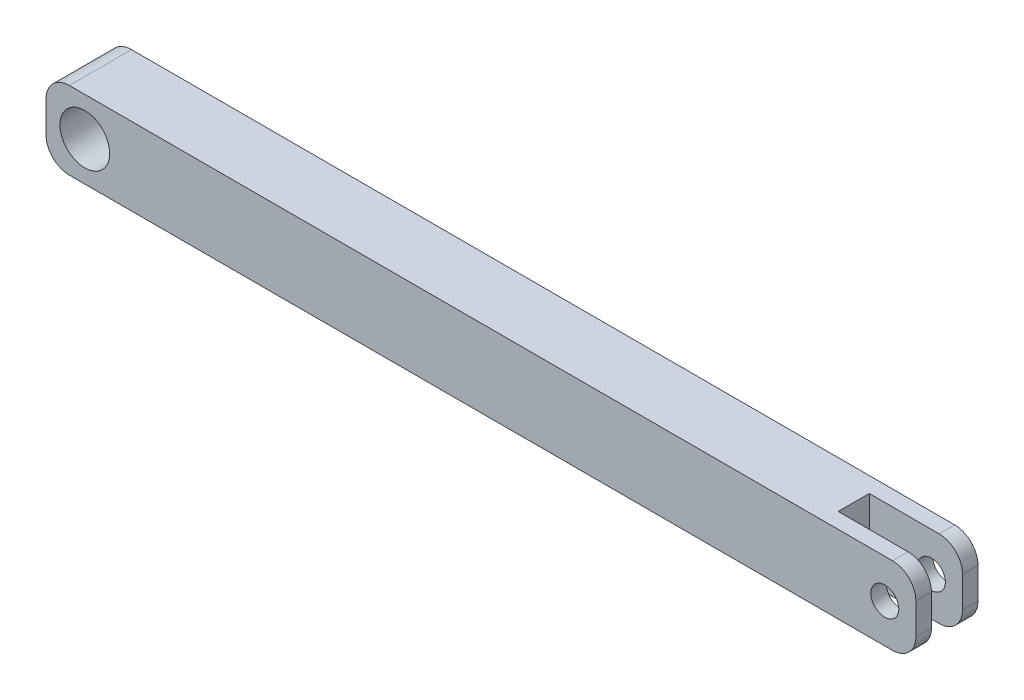
from build123d import *

# Parameters (mm, degrees)
SKETCH_5_W          = 56
SKETCH_5_H          = 3
EXTRUDE_1_DEPTH     = 5
CUT_EXTRUDE_1_REACH = 58.303
SKETCH_6_R          = 1.6
CUT_EXTRUDE_2_REACH = 58.303
SKETCH_7_R          = 0.9
FILLET_1_R          = 1.5
SKETCH_8_W          = 6
SKETCH_8_H          = 1.6
CUT_EXTRUDE_3_DEPTH = 10
SKETCH_10_R         = 1.6
SKETCH_10_R_2       = 0.9
EXTRUDE_2_DEPTH     = 0.5
EXTRUDE_START       = 0.5
SKETCH_11_R         = 0.9
SKETCH_11_R_2       = 1.6
EXTRUDE_3_DEPTH     = 0.5
SKETCH_12_W         = 6.20639004
SKETCH_12_H         = 2
CUT_EXTRUDE_4_DEPTH = 10


with BuildPart() as part:
    # 草图5 → 凸台-拉伸1 (new body)
    with BuildSketch(Plane(origin=(0, 0, 0), x_dir=(1, 0, 0), z_dir=(0, 1, 0))):
        with Locations((28, -1.5)):
            Rectangle(SKETCH_5_W, SKETCH_5_H)
    extrude(amount=EXTRUDE_1_DEPTH)

    # 草图6 → 切除-拉伸1 (cut, up to next)
    with BuildSketch(Plane.XY.offset(3), mode=Mode.PRIVATE) as cut_extrude_1_sk1:
        with Locations((2.5, 2.5)):
            Circle(SKETCH_6_R)
    cut_extrude_1_tool1 = extrude(cut_extrude_1_sk1.sketch, amount=-CUT_EXTRUDE_1_REACH, mode=Mode.PRIVATE) & part.part
    add(cut_extrude_1_tool1.solids().sort_by_distance((2.5, 2.5, 3))[0], mode=Mode.SUBTRACT)

    # 草图7 → 切除-拉伸2 (cut, up to next)
    with BuildSketch(Plane.XY, mode=Mode.PRIVATE) as cut_extrude_2_sk1:
        with Locations(Location((54, 2.5, 0), (0, 0, 180))):
            Circle(SKETCH_7_R)
    cut_extrude_2_tool1 = extrude(cut_extrude_2_sk1.sketch, amount=CUT_EXTRUDE_2_REACH, mode=Mode.PRIVATE) & part.part
    add(cut_extrude_2_tool1.solids().sort_by_distance((54, 2.5, 0))[0], mode=Mode.SUBTRACT)

    # 圆角1
    fillet_1_edges = [part.edges().sort_by_distance(p)[0] for p in [
        (56, 5, 1.5),
        (56, 0, 1.5),
        (0, 0, 1.5),
        (0, 5, 1.5),
    ]]
    fillet(fillet_1_edges, radius=FILLET_1_R)

    # 草图8 → 切除-拉伸3 (cut)
    with BuildSketch(Plane(origin=(0, 5, 0), x_dir=(1, 0, 0), z_dir=(0, 1, 0))):
        with Locations((53, -1.5)):
            Rectangle(SKETCH_8_W, SKETCH_8_H)
    extrude(amount=-CUT_EXTRUDE_3_DEPTH, mode=Mode.SUBTRACT)

    # 草图10 → 凸台-拉伸2 (add)
    with BuildSketch(Plane.XY.offset(3)):
        with BuildLine():
            Line((56, 1.5), (56, 3.5))
            ThreePointArc((56, 3.5), (55.560660172, 4.560660172), (54.5, 5))
            Line((54.5, 5), (1.5, 5))
            ThreePointArc((1.5, 5), (0.439339828, 4.560660172), (0, 3.5))
            Line((0, 3.5), (0, 1.5))
            ThreePointArc((0, 1.5), (0.439339828, 0.439339828), (1.5, 0))
            Line((1.5, 0), (54.5, 0))
            ThreePointArc((54.5, 0), (55.560660172, 0.439339828), (56, 1.5))
        make_face()
        with Locations((2.5, 2.5)):
            Circle(SKETCH_10_R, mode=Mode.SUBTRACT)
        with Locations(Location((54, 2.5, 0), (0, 0, 180))):
            Circle(SKETCH_10_R_2, mode=Mode.SUBTRACT)
    extrude(amount=EXTRUDE_2_DEPTH)

    # 草图11 → 凸台-拉伸3 (add)
    with BuildSketch(Plane(origin=(0, 0, 0), x_dir=(-1, 0, 0), z_dir=(0, 0, -1)).offset(EXTRUDE_START)):
        with BuildLine():
            Line((-1.5, 5), (-54.5, 5))
            ThreePointArc((-54.5, 5), (-55.560660172, 4.560660172), (-56, 3.5))
            Line((-56, 3.5), (-56, 1.5))
            ThreePointArc((-56, 1.5), (-55.560660172, 0.439339828), (-54.5, 0))
            Line((-54.5, 0), (-1.5, 0))
            ThreePointArc((-1.5, 0), (-0.439339828, 0.439339828), (0, 1.5))
            Line((0, 1.5), (0, 3.5))
            ThreePointArc((0, 3.5), (-0.439339828, 4.560660172), (-1.5, 5))
        make_face()
        with Locations((-54, 2.5)):
            Circle(SKETCH_11_R, mode=Mode.SUBTRACT)
        with Locations(Location((-2.5, 2.5, 0), (0, 0, 180))):
            Circle(SKETCH_11_R_2, mode=Mode.SUBTRACT)
    extrude(amount=-EXTRUDE_3_DEPTH)

    # 草图12 → 切除-拉伸4 (cut)
    with BuildSketch(Plane(origin=(0, 5, 0), x_dir=(1, 0, 0), z_dir=(0, 1, 0))):
        with Locations((53.10319502, -1.5)):
            Rectangle(SKETCH_12_W, SKETCH_12_H)
    extrude(amount=-CUT_EXTRUDE_4_DEPTH, mode=Mode.SUBTRACT)


solid = part.part
